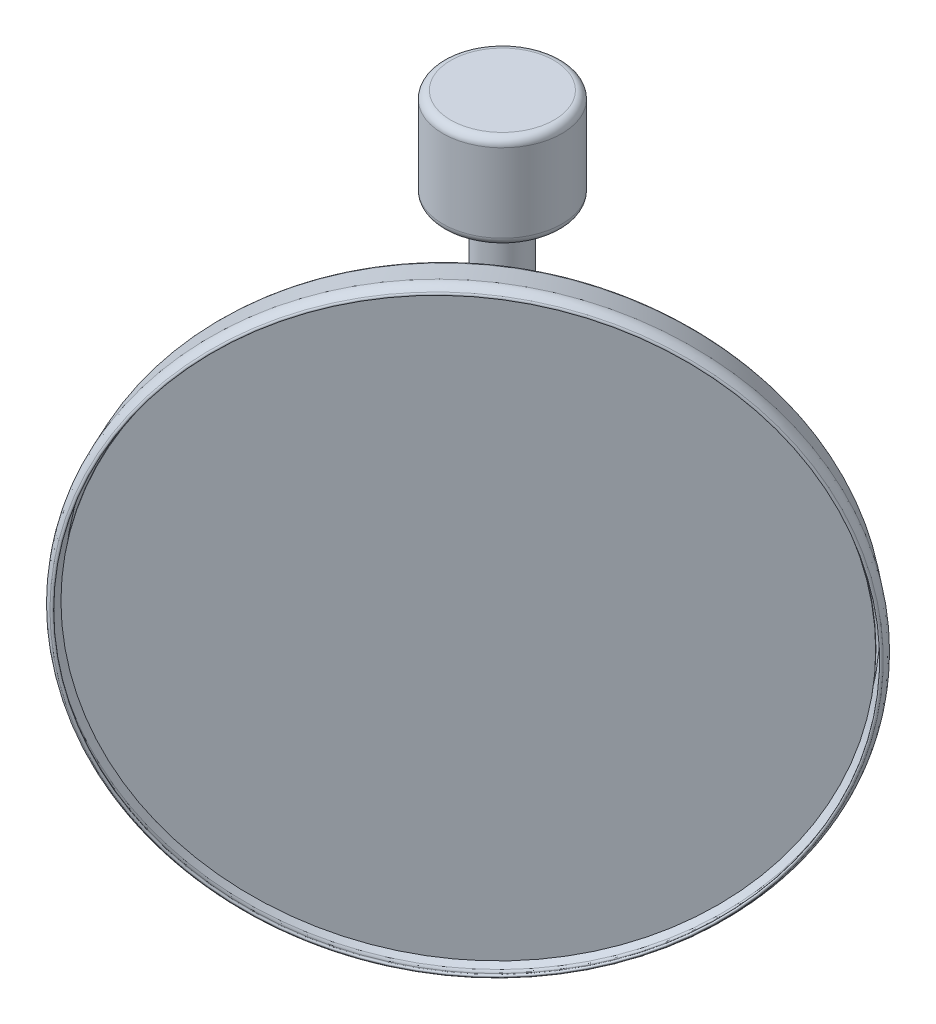
from build123d import *

# Parameters (mm, degrees)
SKETCH5_R           = 92.474495613
BOSS_EXTRUDE1_DEPTH = 0.5
SKETCH9_R           = 8.595469781
BOSS_EXTRUDE2_DEPTH = 5
SKETCH10_R          = 14.027430988
BOSS_EXTRUDE3_DEPTH = 30
SKETCH11_R          = 19
BOSS_EXTRUDE4_DEPTH = 25
FILLET1_R           = 2.5
FILLET2_R           = 1
FILLET3_R           = 2.5
SKETCH12_R          = 7.5
BOSS_EXTRUDE5_DEPTH = 41
BOSS_EXTRUDE6_START = 30
SKETCH13_R          = 19
BOSS_EXTRUDE6_DEPTH = 30
FILLET4_R           = 2.5
FILLET5_R           = 2.5


with BuildPart() as part:
    # Sketch1 → Revolve2 (revolve)
    with BuildSketch(Plane(origin=(0, 0, 0), x_dir=(1, 0, 0), z_dir=(0, 1, 0))):
        with BuildLine():
            Line((-7.76775486, -6.29777615), (-70.44371376, -57.112865639))
            add(Edge.make_bspline(
                [(-70.44371376, -57.112865639), (-71.822615075, -58.523414554), (-71.237269974, -60.487586975)],
                knots=[0, 0, 0, 1, 1, 1], degree=2))
            Line((-71.237269974, -60.487586975), (-66.963402939, -69.250303078))
            add(Edge.make_bspline(
                [(-66.963402939, -69.250303078), (-65.882504125, -70.945096753), (-63.911178875, -71.364830017)],
                knots=[0, 0, 0, 1, 1, 1], degree=2))
            add(Edge.make_bspline(
                [(-64.146340436, -70.268116066), (-62.45290321, -70.920354431), (-63.375689156, -71.536539163), (-63.911178875, -71.364830017)],
                knots=[0, 0, 0, 0, 1, 1, 1, 1], degree=3))
            add(Edge.make_bspline(
                [(-66.090845137, -68.75813972), (-65.970767989, -68.941591309), (-65.694791676, -69.300094516), (-65.246465528, -69.710902844), (-64.742678343, -70.036841759), (-64.346073924, -70.202905782), (-64.146340436, -70.268116066)],
                knots=[0.016474292, 0.016474292, 0.016474292, 0.016474292, 0.226610143, 0.436745994, 0.646881845, 0.857017696, 0.857017696, 0.857017696, 0.857017696], degree=3))
            Line((-66.090845137, -68.75813972), (-70.300300128, -60.127487728))
            add(Edge.make_bspline(
                [(-69.766062835, -57.850827414), (-69.843609869, -57.932806666), (-69.99500421, -58.111983128), (-70.213514773, -58.450383006), (-70.380748103, -58.875225181), (-70.426665484, -59.343403074), (-70.386046827, -59.767321756), (-70.332248828, -60.011654792), (-70.300300128, -60.127487728)],
                knots=[0.017932076, 0.017932076, 0.017932076, 0.017932076, 0.137682584, 0.257433091, 0.496934106, 0.736435121, 0.856185629, 0.975936136, 0.975936136, 0.975936136, 0.975936136], degree=3))
            Line((-69.766062835, -57.850827414), (-7.914752732, -7.704329251))
            Line((-7.914752732, -7.704329251), (-7.137977246, -7.074551636))
            Line((-7.137977246, -7.074551636), (-7.76775486, -6.29777615))
        make_face()
    revolve(axis=Axis((0, 0, 0), (0.6297776142258937, 0, 0.7767754866239932)))

    # Sketch6 → Revolve3 (revolve)
    with BuildSketch(Plane(origin=(0, 0, 0), x_dir=(1, 0, 0), z_dir=(0, 1, 0))):
        with BuildLine():
            Line((70.443713767, 57.112865631), (0, 0))
            Line((0, 0), (-12.595552285, 15.535509732))
            add(Edge.make_bspline(
                [(-12.595552285, 15.535509732), (10.885685638, 34.573131609), (57.143290906, 63.703672783), (70.443713767, 57.112865631)],
                knots=[0.5, 0.5, 0.5, 0.5, 1, 1, 1, 1], degree=3))
        make_face()
    revolve(axis=Axis((0, 0, 0), (-0.6297776142258936, 0, -0.7767754866239933)))

    # Sketch8 → Revolve4 (revolve)
    with BuildSketch(Plane(origin=(0, 0, 0), x_dir=(1, 0, 0), z_dir=(0, 1, 0))):
        with BuildLine():
            Line((-15.884962671, 22.513863012), (-11.161630564, 16.688046862))
            add(Edge.make_bspline(
                [(3.284698476, 27.455213212), (-1.993256306, 23.748954246), (-6.907533961, 20.078654433), (-11.161630564, 16.688046862)],
                knots=[0.902727244, 0.902727244, 0.902727244, 0.902727244, 0.990012573, 0.990012573, 0.990012573, 0.990012573], degree=3))
            Line((3.284698476, 27.455213212), (-1.271304085, 33.074643033))
            ThreePointArc((-1.271304085, 33.074643033), (-1.944136379, 33.439448654), (-2.677857185, 33.221640905))
            Line((-2.677857185, 33.221640905), (-15.884962671, 22.513863012))
        make_face()
    revolve(axis=Axis((-12.595552285, 0, -15.535509732), (-0.629777614226464, 0, -0.7767754866235308)))

    # Sketch9 → Boss-Extrude2 (add)
    with BuildSketch(Plane(origin=(-17.313978921, 0, -21.355275415), x_dir=(-0.7767754866235307, 0, 0.6297776142264643), z_dir=(-0.6297776142264642, 0, -0.7767754866235306))):
        with Locations(Location((0, 0, 0), (0, 0, 180))):
            Circle(SKETCH9_R)
    extrude(amount=BOSS_EXTRUDE2_DEPTH)

    # Sketch10 → Boss-Extrude3 (add)
    with BuildSketch(Plane(origin=(-20.462866992, 0, -25.239152848), x_dir=(-0.7767754866235306, 0, 0.6297776142264645), z_dir=(-0.6297776142264644, 0, -0.7767754866235305))):
        with Locations(Location((0, 0, 0), (0, 0, 180))):
            Circle(SKETCH10_R)
    extrude(amount=BOSS_EXTRUDE3_DEPTH)

    # Sketch11 → Boss-Extrude4 (add, symmetric)
    with BuildSketch(Plane(origin=(0, 0, 0), x_dir=(1, 0, 0), z_dir=(0, 1, 0))):
        with Locations(Location((-39.356195419, 48.542417447, 0), (0, 0, 270))):
            Circle(SKETCH11_R)
    extrude(amount=BOSS_EXTRUDE4_DEPTH, both=True)

    # Fillet1
    fillet1_edges = [part.edges().sort_by_distance(p)[0] for p in [
        (-42.181588932, 0, -29.753666783),
    ]]
    fillet(fillet1_edges, radius=FILLET1_R)

    # Fillet2
    fillet2_edges = [part.edges().sort_by_distance(p)[0] for p in [
        (-31.359031524, 0, -16.404990827),
    ]]
    fillet(fillet2_edges, radius=FILLET2_R)

    # Fillet3
    fillet3_edges = [part.edges().sort_by_distance(p)[0] for p in [
        (-39.356195419, -25, -67.542417447),
    ]]
    fillet(fillet3_edges, radius=FILLET3_R)

    # Sketch12 → Boss-Extrude5 (add)
    with BuildSketch(Plane(origin=(0, 25, 0), x_dir=(1, 0, 0), z_dir=(0, 1, 0))):
        with Locations(Location((-39.356195419, 48.542417447, 0), (0, 0, 270))):
            Circle(SKETCH12_R)
    extrude(amount=BOSS_EXTRUDE5_DEPTH)

    # Sketch13 → Boss-Extrude6 (add)
    with BuildSketch(Plane(origin=(0, 66, 0), x_dir=(1, 0, 0), z_dir=(0, 1, 0)).offset(BOSS_EXTRUDE6_START)):
        with Locations(Location((-39.356195419, 48.542417447, 0), (0, 0, 270))):
            Circle(SKETCH13_R)
    extrude(amount=-BOSS_EXTRUDE6_DEPTH)

    # Fillet4
    fillet4_edges = [part.edges().sort_by_distance(p)[0] for p in [
        (-39.356195419, 96, -67.542417447),
    ]]
    fillet(fillet4_edges, radius=FILLET4_R)

    # Fillet5
    fillet5_edges = [part.edges().sort_by_distance(p)[0] for p in [
        (-39.356195419, 25, -67.542417447),
        (-39.356195419, 25, -56.042417447),
        (-39.356195419, 66, -56.042417447),
        (-39.356195419, 66, -67.542417447),
    ]]
    fillet(fillet5_edges, radius=FILLET5_R)


with BuildPart() as body_2:
    # Sketch5 → Boss-Extrude1 (new body)
    with BuildSketch(Plane(origin=(6.927553763, 0, 8.54453036), x_dir=(0.7767754866239932, 0, -0.6297776142258938), z_dir=(0.6297776142258937, 0, 0.7767754866239931))):
        with Locations(Location((0, 0, 0), (0, 0, 180))):
            Circle(SKETCH5_R)
    extrude(amount=BOSS_EXTRUDE1_DEPTH)


solid = Compound([part.part, body_2.part])
